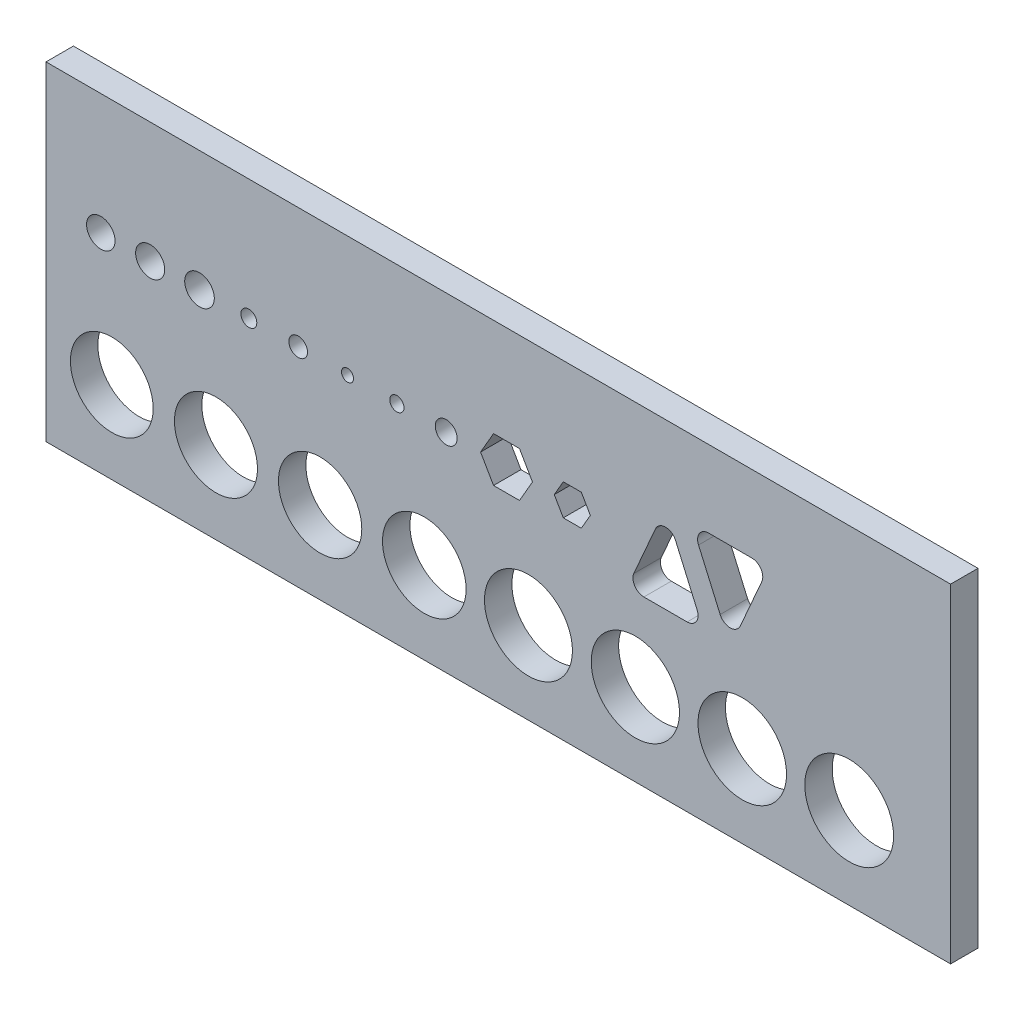
from build123d import *

# Parameters (mm, degrees)
SKETCH1_W           = 165
SKETCH1_H           = 60
SKETCH1_R           = 7.55
SKETCH1_R_2         = 7.575
SKETCH1_R_3         = 7.6
SKETCH1_R_4         = 7.625
SKETCH1_R_5         = 8.025
SKETCH1_R_6         = 8.05
SKETCH1_R_7         = 8.075
SKETCH1_R_8         = 8.1
SKETCH1_R_9         = 2.6
SKETCH1_R_10        = 2.65
SKETCH1_R_11        = 2.7
SKETCH1_R_12        = 1.45
SKETCH1_R_13        = 1.7
SKETCH1_R_14        = 1.1
SKETCH1_R_15        = 1.3
SKETCH1_R_16        = 2
BOSS_EXTRUDE1_DEPTH = 5


with BuildPart() as part:
    # Sketch1 → Boss-Extrude1 (new body)
    with BuildSketch(Plane.XY.offset(300)):
        with Locations((382.5, 330)):
            Rectangle(SKETCH1_W, SKETCH1_H)
        with Locations((312, 315)):
            Circle(SKETCH1_R, mode=Mode.SUBTRACT)
        with Locations((331, 315)):
            Circle(SKETCH1_R_2, mode=Mode.SUBTRACT)
        with Locations((350, 315)):
            Circle(SKETCH1_R_3, mode=Mode.SUBTRACT)
        with Locations((369, 315)):
            Circle(SKETCH1_R_4, mode=Mode.SUBTRACT)
        with Locations((388, 315)):
            Circle(SKETCH1_R_5, mode=Mode.SUBTRACT)
        with Locations((407.5, 315)):
            Circle(SKETCH1_R_6, mode=Mode.SUBTRACT)
        with Locations((427, 315)):
            Circle(SKETCH1_R_7, mode=Mode.SUBTRACT)
        with Locations((446.5, 315)):
            Circle(SKETCH1_R_8, mode=Mode.SUBTRACT)
        with Locations((310, 338)):
            Circle(SKETCH1_R_9, mode=Mode.SUBTRACT)
        with Locations((319, 338)):
            Circle(SKETCH1_R_10, mode=Mode.SUBTRACT)
        with Locations((328, 338)):
            Circle(SKETCH1_R_11, mode=Mode.SUBTRACT)
        with Locations((337, 338)):
            Circle(SKETCH1_R_12, mode=Mode.SUBTRACT)
        with Locations((346, 338)):
            Circle(SKETCH1_R_13, mode=Mode.SUBTRACT)
        with Locations((355, 338)):
            Circle(SKETCH1_R_14, mode=Mode.SUBTRACT)
        with Locations((364, 338)):
            Circle(SKETCH1_R_15, mode=Mode.SUBTRACT)
        with Locations((373, 338)):
            Circle(SKETCH1_R_16, mode=Mode.SUBTRACT)
        Polygon((388.734272207, 338), (386.367136104, 342.1), (381.632863896, 342.1), (379.265727793, 338), (381.632863896, 333.9), (386.367136104, 333.9), align=None, mode=Mode.SUBTRACT)
        Polygon((399.290896534, 338), (397.645448267, 340.85), (394.354551733, 340.85), (392.709103466, 338), (394.354551733, 335.15), (397.645448267, 335.15), align=None, mode=Mode.SUBTRACT)
        with BuildLine():
            Line((409.05803115, 330), (416.94196885, 330))
            ThreePointArc((416.94196885, 330), (418.615778179, 330.90530263), (418.77428352, 332.801637668))
            Line((418.77428352, 332.801637668), (414.83231467, 341.811852183))
            ThreePointArc((414.83231467, 341.811852183), (413, 343.010214515), (411.16768533, 341.811852183))
            Line((411.16768533, 341.811852183), (407.22571648, 332.801637668))
            ThreePointArc((407.22571648, 332.801637668), (407.384221821, 330.90530263), (409.05803115, 330))
        make_face(mode=Mode.SUBTRACT)
        with BuildLine():
            Line((426.63231467, 334.188147817), (430.57428352, 343.198362332))
            ThreePointArc((430.57428352, 343.198362332), (430.415778179, 345.09469737), (428.74196885, 346))
            Line((428.74196885, 346), (420.85803115, 346))
            ThreePointArc((420.85803115, 346), (419.184221821, 345.09469737), (419.02571648, 343.198362332))
            Line((419.02571648, 343.198362332), (422.96768533, 334.188147817))
            ThreePointArc((422.96768533, 334.188147817), (424.8, 332.989785485), (426.63231467, 334.188147817))
        make_face(mode=Mode.SUBTRACT)
    extrude(amount=BOSS_EXTRUDE1_DEPTH)


solid = part.part
